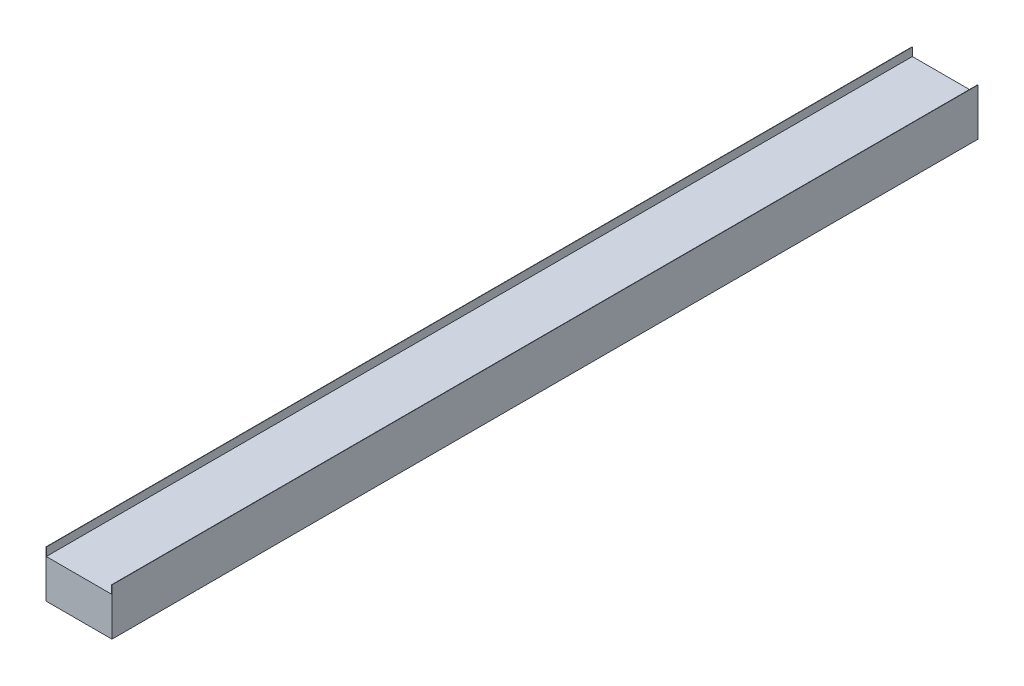
from build123d import *

# Parameters (mm, degrees)
SALIENTE_EXTRUIR1_DEPTH = 10500


with BuildPart() as part:
    # Croquis1 → Saliente-Extruir1 (new body)
    with BuildSketch(Plane.XY):
        Polygon((4, 0), (4, -100), (796, -100), (796, 0), (800, 0), (800, -570), (0, -570), (0, 0), align=None)
    extrude(amount=SALIENTE_EXTRUIR1_DEPTH)


solid = part.part
